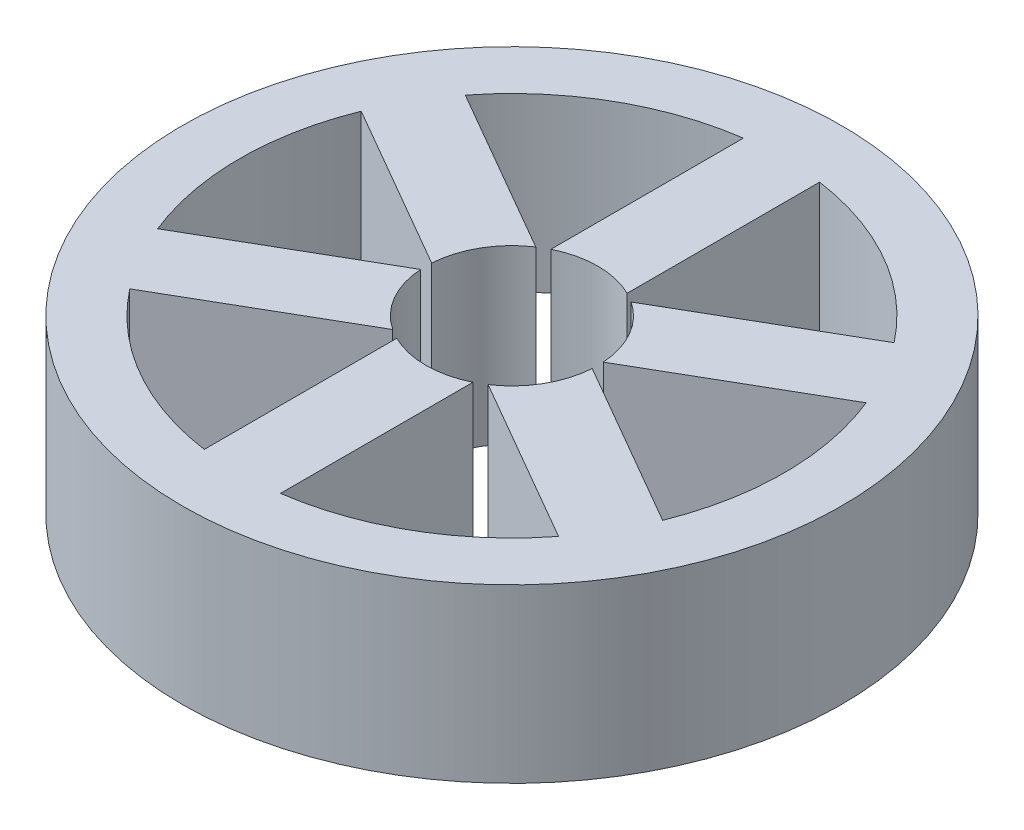
from build123d import *

# Parameters (mm, degrees)
SKETCH1_R           = 5.75
BOSS_EXTRUDE1_DEPTH = 3


with BuildPart() as part:
    # Sketch1 → Boss-Extrude1 (new body)
    with BuildSketch(Plane(origin=(0, 0, 0), x_dir=(1, 0, 0), z_dir=(0, 1, 0))):
        with Locations(Location((0, 0, 0), (0, 0, 270))):
            Circle(SKETCH1_R)
        with BuildLine():
            ThreePointArc((1.496877193, -0.096740213), (1.299038106, -0.75), (0.832218079, -1.247963569))
            Line((0.832218079, -1.247963569), (3.740819863, -2.927245592))
            ThreePointArc((3.740819863, -2.927245592), (2.375, -4.113620668), (0.664659115, -4.703267828))
            Line((0.664659115, -4.703267828), (0.664659115, -1.344703782))
            ThreePointArc((0.664659115, -1.344703782), (0, -1.5), (-0.664659115, -1.344703782))
            Line((-0.664659115, -1.344703782), (-0.664659115, -4.703267828))
            ThreePointArc((-0.664659115, -4.703267828), (-2.375, -4.113620668), (-3.740819863, -2.927245592))
            Line((-3.740819863, -2.927245592), (-0.832218079, -1.247963569))
            ThreePointArc((-0.832218079, -1.247963569), (-1.299038106, -0.75), (-1.496877193, -0.096740213))
            Line((-1.496877193, -0.096740213), (-4.405478977, -1.776022236))
            ThreePointArc((-4.405478977, -1.776022236), (-4.75, 0), (-4.405478977, 1.776022236))
            Line((-4.405478977, 1.776022236), (-1.496877193, 0.096740213))
            ThreePointArc((-1.496877193, 0.096740213), (-1.299038106, 0.75), (-0.832218079, 1.247963569))
            Line((-0.832218079, 1.247963569), (-3.740819863, 2.927245592))
            ThreePointArc((-3.740819863, 2.927245592), (-2.375, 4.113620668), (-0.664659115, 4.703267828))
            Line((-0.664659115, 4.703267828), (-0.664659115, 1.344703782))
            ThreePointArc((-0.664659115, 1.344703782), (0, 1.5), (0.664659115, 1.344703782))
            Line((0.664659115, 1.344703782), (0.664659115, 4.703267828))
            ThreePointArc((0.664659115, 4.703267828), (2.375, 4.113620668), (3.740819863, 2.927245592))
            Line((3.740819863, 2.927245592), (0.832218079, 1.247963569))
            ThreePointArc((0.832218079, 1.247963569), (1.299038106, 0.75), (1.496877193, 0.096740213))
            Line((1.496877193, 0.096740213), (4.405478977, 1.776022236))
            ThreePointArc((4.405478977, 1.776022236), (4.75, 0), (4.405478977, -1.776022236))
            Line((4.405478977, -1.776022236), (1.496877193, -0.096740213))
        make_face(mode=Mode.SUBTRACT)
    extrude(amount=BOSS_EXTRUDE1_DEPTH)


solid = part.part
